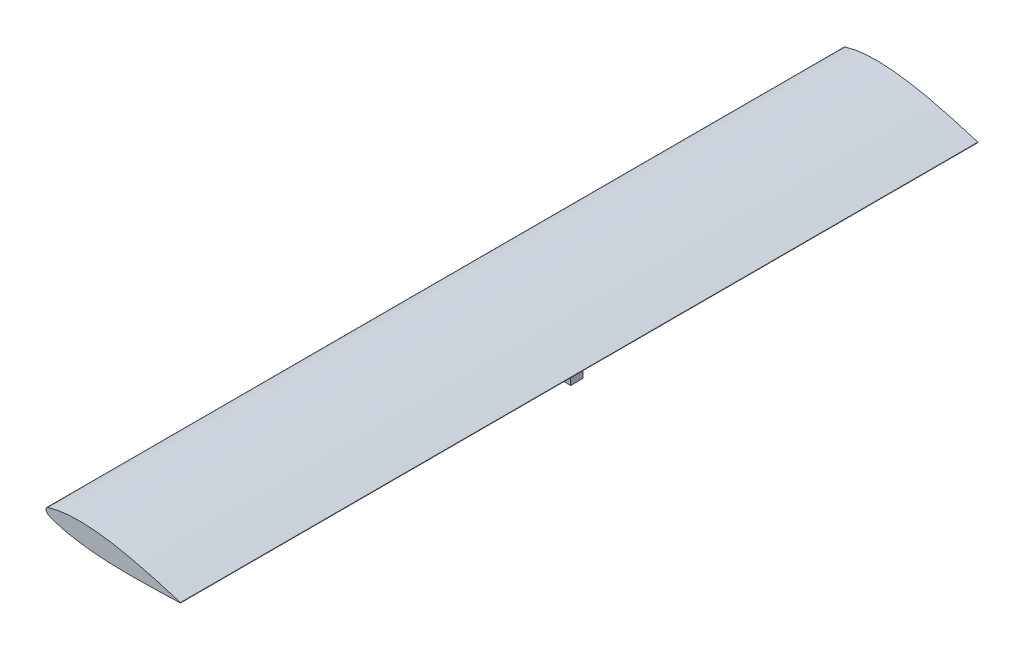
from build123d import *

# Parameters (mm, degrees)
BOSS_EXTRUDE1_DEPTH = 1590
FILLET1_R           = 0.5
BOSS_EXTRUDE2_REACH = 1615.553
SKETCH6_W           = 250
SKETCH6_H           = 25


with BuildPart() as part:
    # Sketch2 → Boss-Extrude1 (new body)
    with BuildSketch(Plane.XY):
        with BuildLine():
            add(Edge.make_bspline(
                [(3.131212666, 5.549288034), (72.834644418, 27.433106924), (171.280571566, 3.725712841), (270.840654693, -27.169463842)],
                knots=[0, 0, 0, 0, 1, 1, 1, 1], degree=3))
            add(Edge.make_bspline(
                [(9.290484609, -9.081039263), (82.88892322, -36.554453489), (198.099785008, -28.782078902), (270.840654693, -27.169463842)],
                knots=[0, 0, 0, 0, 1, 1, 1, 1], degree=3))
            add(Edge.make_bspline(
                [(3.131212666, 5.549288034), (-1.83338348, 3.990622698), (-1.886589783, -4.908771476), (9.290484609, -9.081039263)],
                knots=[0, 0, 0, 0, 1, 1, 1, 1], degree=3))
        make_face()
    extrude(amount=BOSS_EXTRUDE1_DEPTH)

    # Fillet1
    fillet1_edges = [part.edges().sort_by_distance(p)[0] for p in [
        (270.840654693, -27.169463842, 795),
    ]]
    fillet(fillet1_edges, radius=FILLET1_R)

    # Sketch6 → Boss-Extrude2 (add, up to next)
    with BuildSketch(Plane(origin=(0, -45, 0), x_dir=(1, 0, 0), z_dir=(0, 1, 0)), mode=Mode.PRIVATE) as boss_extrude2_sk1:
        with Locations((138.533596353, -795)):
            Rectangle(SKETCH6_W, SKETCH6_H)
    boss_extrude2_tool1 = extrude(boss_extrude2_sk1.sketch, amount=BOSS_EXTRUDE2_REACH, mode=Mode.PRIVATE) - part.part
    add(boss_extrude2_tool1.solids().sort_by_distance((138.533596, -45, 795))[0])


solid = part.part
